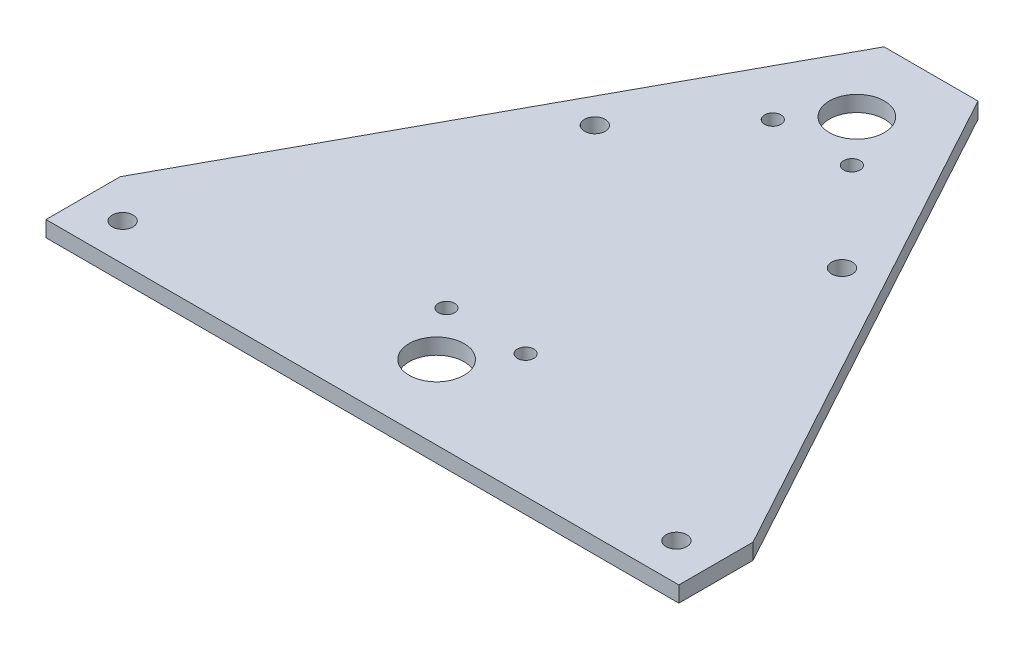
from build123d import *

# Parameters (mm, degrees)
SKETCH1_R           = 27.8
SKETCH1_R_2         = 8.3
SKETCH1_R_3         = 10.5
BOSS_EXTRUDE1_DEPTH = 16


with BuildPart() as part:
    # Sketch1 → Boss-Extrude1 (new body)
    with BuildSketch(Plane(origin=(0, 0, 0), x_dir=(-1, 0, 0), z_dir=(0, 1, 0))):
        Polygon((-320, 75), (320, 75), (320, 0), (47.5, -500), (-47.5, -500), (-320, 0), align=None)
        with Locations(Location((0, 0, 0), (0, 0, 90))):
            Circle(SKETCH1_R, mode=Mode.SUBTRACT)
        with Locations(Location((0, -425, 0), (0, 0, 90))):
            Circle(SKETCH1_R, mode=Mode.SUBTRACT)
        with Locations(Location((-40, -50, 0), (0, 0, 90))):
            Circle(SKETCH1_R_2, mode=Mode.SUBTRACT)
        with Locations(Location((40, -50, 0), (0, 0, 270))):
            Circle(SKETCH1_R_2, mode=Mode.SUBTRACT)
        with Locations(Location((-40, -380, 0), (0, 0, 90))):
            Circle(SKETCH1_R_2, mode=Mode.SUBTRACT)
        with Locations(Location((40, -380, 0), (0, 0, 270))):
            Circle(SKETCH1_R_2, mode=Mode.SUBTRACT)
        with Locations(Location((-280, 37.5, 0), (0, 0, 90))):
            Circle(SKETCH1_R_3, mode=Mode.SUBTRACT)
        with Locations(Location((280, 37.5, 0), (0, 0, 270))):
            Circle(SKETCH1_R_3, mode=Mode.SUBTRACT)
        with Locations(Location((-125, -285, 0), (0, 0, 90))):
            Circle(SKETCH1_R_3, mode=Mode.SUBTRACT)
        with Locations(Location((125, -285, 0), (0, 0, 270))):
            Circle(SKETCH1_R_3, mode=Mode.SUBTRACT)
    extrude(amount=BOSS_EXTRUDE1_DEPTH)


solid = part.part
